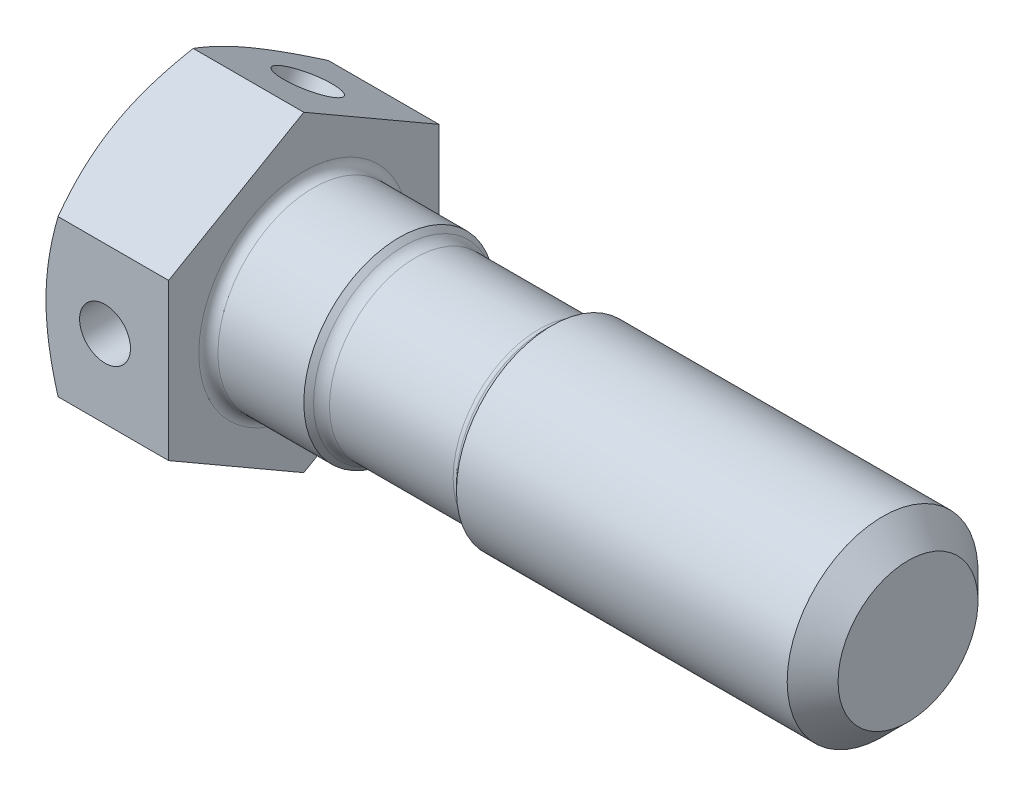
from build123d import *

# Parameters (mm, degrees)
EXTRUDE_1_DEPTH     = 8
SKETCH_3_OUTSIDE_W  = 198.604
SKETCH_3_OUTSIDE_H  = 201.234
SKETCH_3_OUTSIDE_R  = 8
CUT_EXTRUDE_1_DEPTH = 48.797315127
CUT_EXTRUDE_1_DRAFT = -60
FILLET_1_R          = 0.6
SKETCH_4_R          = 1.6
CUT_EXTRUDE_2_DEPTH = 43.770706486
SKETCH_5_R          = 1.75
CUT_EXTRUDE_3_DEPTH = 44.607147732


with BuildPart() as part:
    # Эскиз1 → Повернуть1 (revolve)
    with BuildSketch(Plane.XY, mode=Mode.PRIVATE) as revolve_1_sk:
        with BuildLine():
            Line((0, 0), (0, 6))
            Line((0, 6), (6, 6))
            Line((6, 6), (6.307106781, 5.692893219))
            ThreePointArc((6.307106781, 5.692893219), (6.63153013, 5.476120467), (7.014213562, 5.4))
            Line((7.014213562, 5.4), (14.792893219, 5.4))
            ThreePointArc((14.792893219, 5.4), (14.984234935, 5.438060234), (15.146446609, 5.546446609))
            Line((15.146446609, 5.546446609), (15.6, 6))
            Line((15.6, 6), (36.4, 6))
            Line((36.4, 6), (38, 4.4))
            Line((38, 4.4), (38, 0))
            Line((38, 0), (0, 0))
        make_face()
    revolve(revolve_1_sk.sketch.rotate(Axis((0, 0, 0), (1, 0, 0)), 90), axis=Axis((0, 0, 0), (1, 0, 0)))

    # Эскиз2 → Бобышка-Вытянуть1 (add)
    with BuildSketch(Plane.ZY):
        Polygon((0, -9.814954576), (8.5, -4.907477288), (8.5, 4.907477288), (0, 9.814954576), (-8.5, 4.907477288), (-8.5, -4.907477288), align=None)
    extrude(amount=EXTRUDE_1_DEPTH)


with BuildPart() as cut_extrude_1_tool:
    # Эскиз3 outside → Вырез-Вытянуть1 (with draft: the straight prism first)
    with BuildSketch(Plane.ZY.offset(8)):
        Rectangle(SKETCH_3_OUTSIDE_W, SKETCH_3_OUTSIDE_H)
        Circle(SKETCH_3_OUTSIDE_R, mode=Mode.SUBTRACT)
    extrude(amount=-CUT_EXTRUDE_1_DEPTH)
    # Вырез-Вытянуть1: the draft: its side faces are tilted about the plane it starts from
    cut_extrude_1_sides = [cut_extrude_1_tool.faces().sort_by_distance(p)[0] for p in [
        (16.398657563, -100.617, 0),
        (16.398657563, 0, 99.302),
        (16.398657563, 100.617, 0),
        (16.398657563, 0, -99.302),
        (16.398657563, 0, -8),
    ]]
    draft(cut_extrude_1_sides, Plane.ZY.offset(8), CUT_EXTRUDE_1_DRAFT)


with BuildPart() as part_1:
    add(part.part)

    # Вырез-Вытянуть1: cut by cut_extrude_1_tool
    add(cut_extrude_1_tool.part, mode=Mode.SUBTRACT)

    # Скругление1
    fillet_1_edges = [part_1.edges().sort_by_distance(p)[0] for p in [
        (0, 0, -6),
    ]]
    fillet(fillet_1_edges, radius=FILLET_1_R)

    # Эскиз4 → Вырез-Вытянуть2 (cut, through all)
    with BuildSketch(Plane.XY.offset(8.5)):
        with Locations((-4, 0)):
            Circle(SKETCH_4_R)
    extrude(amount=-CUT_EXTRUDE_2_DEPTH, mode=Mode.SUBTRACT)

    # Эскиз5 → Вырез-Вытянуть3 (cut, through all)
    with BuildSketch(Plane(origin=(0, -7.361215932, 4.25), x_dir=(1, 0, 0), z_dir=(0, -0.8660254037844385, 0.5000000000000004))):
        with Locations(Location((-4, 0, 0), (0, 0, 270))):
            Circle(SKETCH_5_R)
    extrude(amount=-CUT_EXTRUDE_3_DEPTH, mode=Mode.SUBTRACT)


solid = part_1.part
